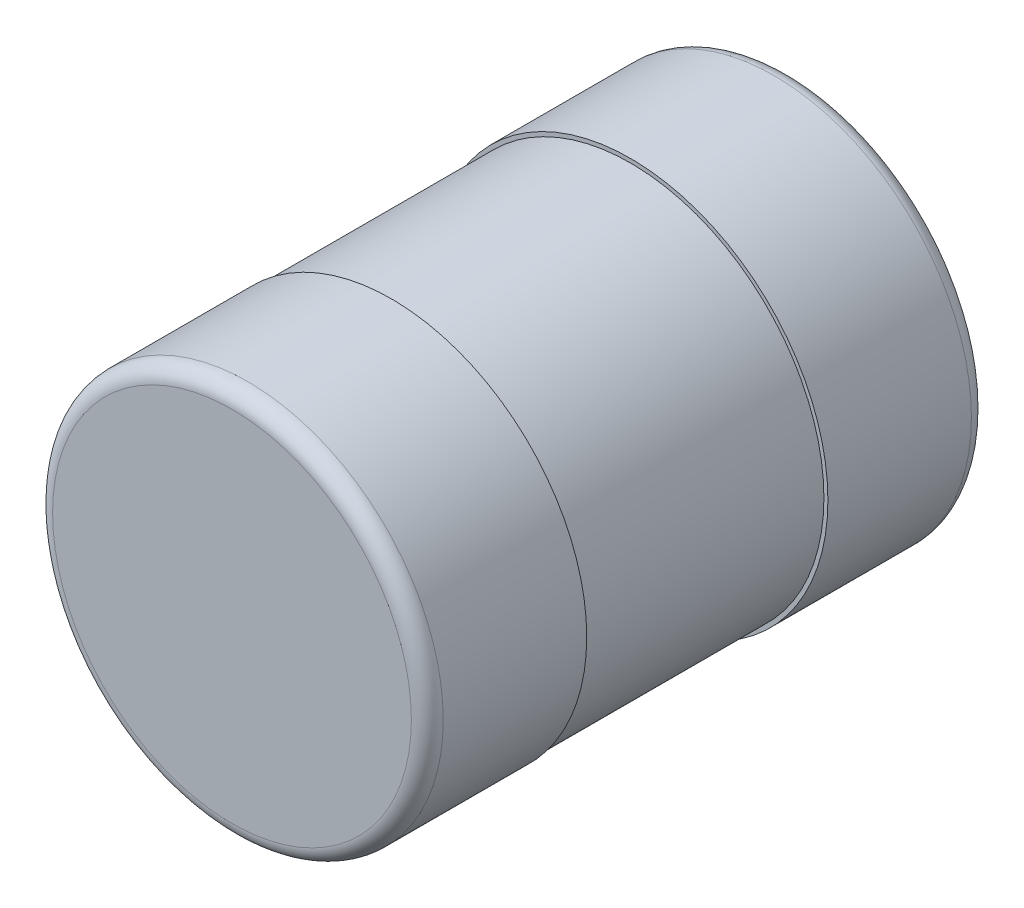
from build123d import *

# Parameters (mm, degrees)
SKETCH_1_R      = 2.475
EXTRUDE_1_DEPTH = 2
SKETCH_2_R      = 2.425
EXTRUDE_2_DEPTH = 3
SKETCH_3_R      = 2.45
EXTRUDE_3_DEPTH = 2
FILLET_1_R      = 0.2


with BuildPart() as part:
    # 스케치1 → 보스-돌출1 (new body)
    with BuildSketch(Plane.XY):
        Circle(SKETCH_1_R)
    extrude(amount=EXTRUDE_1_DEPTH)

    # 스케치2 → 보스-돌출2 (add)
    with BuildSketch(Plane.XY.offset(2)):
        Circle(SKETCH_2_R)
    extrude(amount=EXTRUDE_2_DEPTH)

    # 스케치3 → 보스-돌출3 (add)
    with BuildSketch(Plane.XY.offset(5)):
        Circle(SKETCH_3_R)
    extrude(amount=EXTRUDE_3_DEPTH)

    # 필렛1
    fillet_1_edges = [part.edges().sort_by_distance(p)[0] for p in [
        (-2.475, 0, 0),
        (-2.45, 0, 7),
    ]]
    fillet(fillet_1_edges, radius=FILLET_1_R)


solid = part.part
